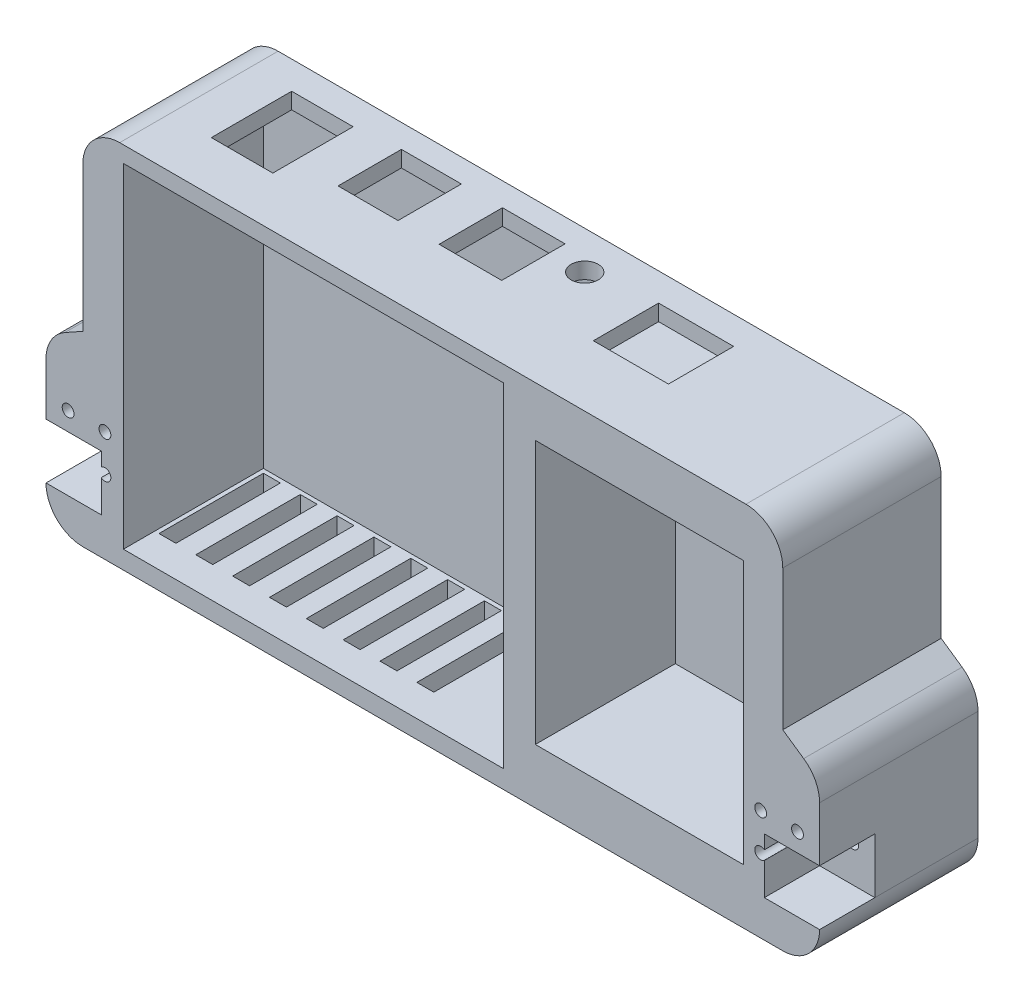
from build123d import *

# Parameters (mm, degrees)
SKETCH_1_W          = 103.2
SKETCH_1_H          = 90.7
SKETCH_1_W_2        = 56.5
SKETCH_1_H_2        = 71.5
EXTRUDE_1_DEPTH     = 43
EXTRUDE_3_DEPTH     = 5
SKETCH_4_R          = 3.682623049
SKETCH_4_W          = 20.371137154
SKETCH_4_H          = 17.709581546
SKETCH_4_W_2        = 16.685906313
SKETCH_4_H_2        = 21.804282482
SKETCH_4_W_3        = 16.276436219
SKETCH_4_H_3        = 17.19774393
SKETCH_4_W_4        = 16.993008883
CUT_EXTRUDE_2_DEPTH = 4.377522815
SKETCH_5_W          = 4.606538552
SKETCH_5_H          = 28.355803979
CUT_EXTRUDE_3_DEPTH = 4.922477185
SKETCH_7_R          = 1.6
CUT_EXTRUDE_4_DEPTH = 237.535409611
SKETCH_8_W          = 15
SKETCH_8_H          = 15
CUT_EXTRUDE_5_DEPTH = 15


with BuildPart() as part:
    # 草图1 → 凸台-拉伸1 (new body)
    with BuildSketch(Plane.XY):
        with BuildLine():
            Line((0, 10), (0, 39.186569494))
            ThreePointArc((0, 39.186569494), (1.375838219, 44.248568464), (5.124766715, 47.917669105))
            Line((5.124766715, 47.917669105), (10, 50.639880584))
            Line((10, 50.639880584), (10, 90))
            ThreePointArc((10, 90), (12.928932188, 97.071067812), (20, 100))
            Line((20, 100), (190, 100))
            ThreePointArc((190, 100), (197.071067812, 97.071067812), (200, 90))
            Line((200, 90), (200, 51.963395008))
            Line((200, 51.963395008), (205.683304945, 48.037782396))
            ThreePointArc((205.683304945, 48.037782396), (208.855310538, 44.455580593), (210, 39.809778695))
            Line((210, 39.809778695), (210, 10))
            ThreePointArc((210, 10), (207.071067812, 2.928932188), (200, 0))
            Line((200, 0), (10, 0))
            ThreePointArc((10, 0), (2.928932188, 2.928932188), (0, 10))
        make_face()
        with Locations((72.614593403, 50.272477185)):
            Rectangle(SKETCH_1_W, SKETCH_1_H, mode=Mode.SUBTRACT)
        with Locations((161.079111209, 50.675353005)):
            Rectangle(SKETCH_1_W_2, SKETCH_1_H_2, mode=Mode.SUBTRACT)
    extrude(amount=EXTRUDE_1_DEPTH)

    # 草图3 → 凸台-拉伸3 (add)
    with BuildSketch(Plane.XY):
        with BuildLine():
            Line((0, 10), (0, 39.186569494))
            ThreePointArc((0, 39.186569494), (1.375838219, 44.248568464), (5.124766715, 47.917669105))
            Line((5.124766715, 47.917669105), (10, 50.639880584))
            Line((10, 50.639880584), (10, 90))
            ThreePointArc((10, 90), (12.928932188, 97.071067812), (20, 100))
            Line((20, 100), (180, 100))
            ThreePointArc((180, 100), (187.071067812, 97.071067812), (190, 90))
            Line((190, 90), (190, 51.963395008))
            Line((190, 51.963395008), (195.683304945, 48.037782396))
            ThreePointArc((195.683304945, 48.037782396), (198.855310538, 44.455580593), (200, 39.809778695))
            Line((200, 39.809778695), (200, 10))
            ThreePointArc((200, 10), (197.071067812, 2.928932188), (190, 0))
            Line((190, 0), (10, 0))
            ThreePointArc((10, 0), (2.928932188, 2.928932188), (0, 10))
        make_face()
    extrude(amount=EXTRUDE_3_DEPTH)

    # 草图4 → 切除-拉伸2 (cut)
    with BuildSketch(Plane(origin=(0, 100, 0), x_dir=(1, 0, 0), z_dir=(0, 1, 0))):
        with Locations(Location((113.563696849, -10.32262821, 0), (0, 0, 180))):
            Circle(SKETCH_4_R)
        with Locations((141.053854619, -16.426982565)):
            Rectangle(SKETCH_4_W, SKETCH_4_H)
        with Locations((39.603161201, -18.474333033)):
            Rectangle(SKETCH_4_W_2, SKETCH_4_H_2)
        with Locations((67.958965179, -14.942653476)):
            Rectangle(SKETCH_4_W_3, SKETCH_4_H_3)
        with Locations((95.751747779, -14.942653476)):
            Rectangle(SKETCH_4_W_4, SKETCH_4_H_3)
    extrude(amount=-CUT_EXTRUDE_2_DEPTH, mode=Mode.SUBTRACT)

    # 草图5 → 切除-拉伸3 (cut)
    with BuildSketch(Plane.XZ):
        with Locations((34.452767739, 20.30710257)):
            Rectangle(SKETCH_5_W, SKETCH_5_H)
        with Locations((24.452767739, 20.30710257)):
            Rectangle(SKETCH_5_W, SKETCH_5_H)
        with Locations((44.452767739, 20.30710257)):
            Rectangle(SKETCH_5_W, SKETCH_5_H)
        with Locations((54.452767739, 20.30710257)):
            Rectangle(SKETCH_5_W, SKETCH_5_H)
        with Locations((64.452767739, 20.30710257)):
            Rectangle(SKETCH_5_W, SKETCH_5_H)
        with Locations((74.452767739, 20.30710257)):
            Rectangle(SKETCH_5_W, SKETCH_5_H)
        with Locations((84.452767739, 20.30710257)):
            Rectangle(SKETCH_5_W, SKETCH_5_H)
        with Locations((94.452767739, 20.30710257)):
            Rectangle(SKETCH_5_W, SKETCH_5_H)
    extrude(amount=-CUT_EXTRUDE_3_DEPTH, mode=Mode.SUBTRACT)

    # 草图7 → 切除-拉伸4 (cut, through all)
    with BuildSketch(Plane.XY.offset(43)):
        with Locations((6, 30)):
            Circle(SKETCH_7_R)
        with Locations((16, 30)):
            Circle(SKETCH_7_R)
        with Locations((16, 20)):
            Circle(SKETCH_7_R)
        with Locations((6, 20)):
            Circle(SKETCH_7_R)
        with Locations((194, 30)):
            Circle(SKETCH_7_R)
        with Locations((204, 30)):
            Circle(SKETCH_7_R)
        with Locations((204, 20)):
            Circle(SKETCH_7_R)
        with Locations((194, 20)):
            Circle(SKETCH_7_R)
    extrude(amount=-CUT_EXTRUDE_4_DEPTH, mode=Mode.SUBTRACT)

    # 草图8 → 切除-拉伸5 (cut)
    with BuildSketch(Plane.ZY):
        with Locations((35.5, 17.5)):
            Rectangle(SKETCH_8_W, SKETCH_8_H)
    cut_extrude_5 = extrude(amount=-CUT_EXTRUDE_5_DEPTH, mode=Mode.SUBTRACT)

    # 镜向1: 切除-拉伸5 across plane
    add(cut_extrude_5.mirror(Plane.ZY.offset(-105)), mode=Mode.SUBTRACT)


solid = part.part
